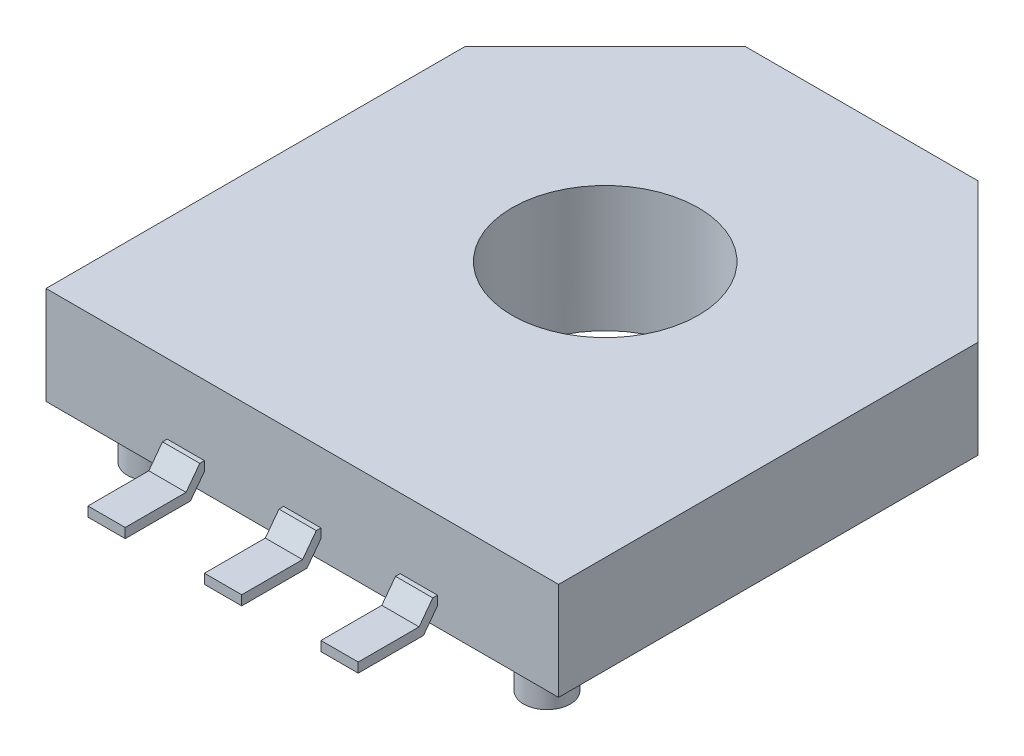
from build123d import *
from build123d.topology import SkipClean

# Parameters (mm, degrees)
SKETCH1_R           = 2
BOSS_EXTRUDE1_DEPTH = 2.1
BOSS_EXTRUDE2_START = 0.6
SKETCH2_R           = 2.5
SKETCH2_R_2         = 2
BOSS_EXTRUDE2_DEPTH = 0.6
SKETCH3_R           = 0.5
BOSS_EXTRUDE3_DEPTH = 1
BOSS_EXTRUDE4_DEPTH = 0.4
LPATTERN1_COUNT     = 2
LPATTERN1_PITCH     = 2.5
LPATTERN1_COL_COUNT = 2
LPATTERN1_COL_PITCH = 2.5


with BuildPart() as part:
    # Sketch1 → Boss-Extrude1 (new body)
    with BuildSketch(Plane(origin=(0, 0, 0), x_dir=(1, 0, 0), z_dir=(0, 1, 0))):
        Polygon((-5.5, -6.5), (5.5, -6.5), (5.5, 2.5), (2.5, 5.5), (-2.5, 5.5), (-5.5, 2.5), align=None)
        with Locations(Location((0, 0, 0), (0, 0, 270))):
            Circle(SKETCH1_R, mode=Mode.SUBTRACT)
    extrude(amount=BOSS_EXTRUDE1_DEPTH)

    # Sketch2 → Boss-Extrude2 (add)
    with SkipClean():  # the faces are left unmerged after this step: merging them gives an invalid solid
        with BuildSketch(Plane.XZ.offset(BOSS_EXTRUDE2_START)):
            with Locations(Location((0, 0, 0), (0, 0, 270))):
                Circle(SKETCH2_R)
            with Locations(Location((0, 0, 0), (0, 0, 270))):
                Circle(SKETCH2_R_2, mode=Mode.SUBTRACT)
        extrude(amount=-BOSS_EXTRUDE2_DEPTH)

    # Sketch3 → Boss-Extrude3 (add)
    with SkipClean():  # the faces are left unmerged after this step: merging them gives an invalid solid
        with BuildSketch(Plane.XZ):
            with Locations(Location((4.250000001, 5.5, 0), (0, 0, 270))):
                Circle(SKETCH3_R)
            with Locations(Location((-4.249999999, 5.5, 0), (0, 0, 270))):
                Circle(SKETCH3_R)
        extrude(amount=BOSS_EXTRUDE3_DEPTH)

    # Sketch4 → Boss-Extrude4 (add, symmetric)
    with SkipClean():  # the faces are left unmerged after this step: merging them gives an invalid solid
        with BuildSketch(Plane(origin=(0, 0, 0), x_dir=(0, 0, -1), z_dir=(1, 0, 0))):
            Polygon((-6.5, 0.6), (-6.5, 0.4), (-6.8, 0), (-8.2, 0), (-8.2, 0.207806039), (-6.894145471, 0.207806039), (-6.600159334, 0.599787555), align=None)
        boss_extrude4 = extrude(amount=BOSS_EXTRUDE4_DEPTH, both=True)

    # LPattern1: Boss-Extrude4 ×2
    with SkipClean():  # the faces are left unmerged after this step: merging them gives an invalid solid
        with Locations(*[(i * LPATTERN1_PITCH, 0, 0) for i in range(1, LPATTERN1_COUNT)]):
            add(boss_extrude4)

    # LPattern1 col: Boss-Extrude4 ×2
    with SkipClean():  # the faces are left unmerged after this step: merging them gives an invalid solid
        with Locations(*[(-i * LPATTERN1_COL_PITCH, 0, 0) for i in range(1, LPATTERN1_COL_COUNT)]):
            add(boss_extrude4)

    # Mirror1: Boss-Extrude4 across plane
    with SkipClean():  # the faces are left unmerged after this step: merging them gives an invalid solid
        add(boss_extrude4.mirror(Plane.XY.offset(0.5)))


solid = part.part
